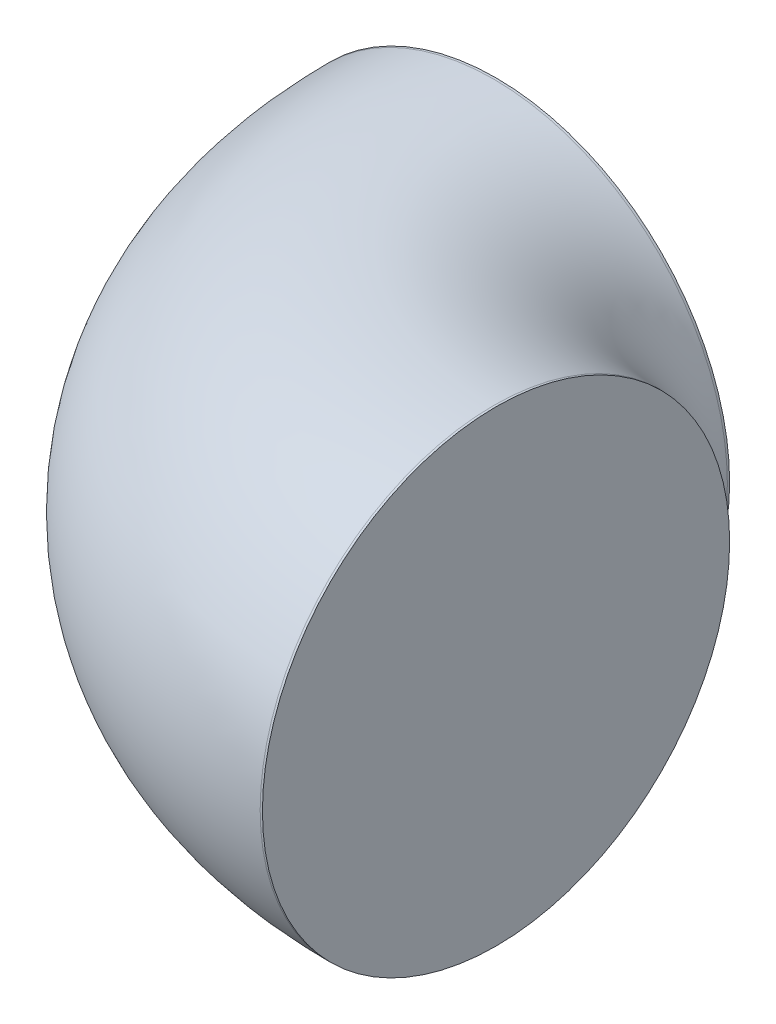
from build123d import *

# Parameters (mm, degrees)
SWEEP2_PROFILE_R = 26.25


with BuildPart() as part:
    # Sweep2: sweep along a path in Sketch9
    with BuildLine(Plane(origin=(0, 0, 0), x_dir=(1, 0, 0), z_dir=(0, 1, 0))) as sweep2_path:
        Line((-58.061409572, 23.268891831), (-58.061409572, 23.014891831))
        ThreePointArc((-58.061409572, 23.014891831), (-48.762049874, 0.564251528), (-26.311409572, -8.735108169))
        Line((-26.311409572, -8.735108169), (-26.057409572, -8.735108169))
    # Sweep2 profile (on start of the path) → Sweep2 (sweep)
    with BuildSketch(Plane(origin=(-58.061409572, 0, -23.268891831), x_dir=(1, 0, 0), z_dir=(0, 0, 1))):
        Circle(SWEEP2_PROFILE_R)
    sweep(path=sweep2_path.line)


solid = part.part
